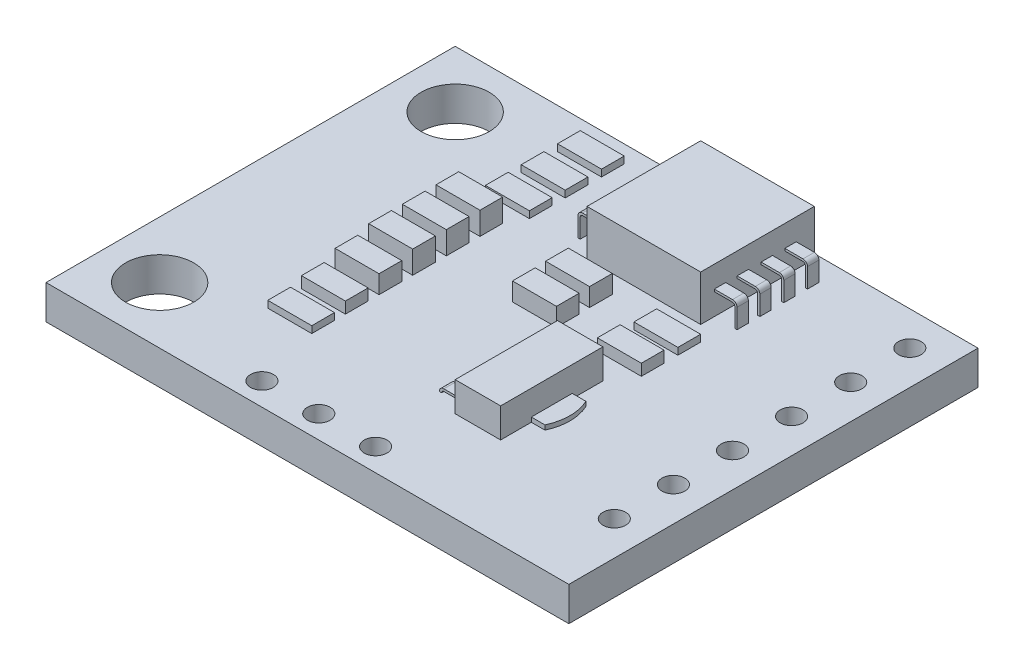
from build123d import *

# Parameters (mm, degrees)
ESBO_O1_W                           = 23
ESBO_O1_H                           = 18
PCB_DEPTH                           = 1.5
ESBO_O7_R                           = 1.5
ESBO_O7_R_2                         = 0.5
FUROS_DEPTH                         = 30.244657632
ESBO_O11_W                          = 5
ESBO_O11_H                          = 5
CHIP_DEPTH                          = 2
ESBO_O12_W                          = 2
ESBO_O12_H                          = 4.5
REGULADOR_TENSAO_DEPTH              = 1.3
ESBO_O13_W                          = 1.934940779
ESBO_O13_H                          = 1
RESISTORES_1_DEPTH                  = 1
ESBO_O14_W                          = 1.934940779
ESBO_O14_H                          = 1
ESBO_O14_W_2                        = 1.934940778
RESISTORES_2_DEPTH                  = 0.8
ESBO_O16_W                          = 1.934940779
ESBO_O16_H                          = 1
LEDS_DEPTH                          = 0.5
ESBO_O17_W                          = 1.934940779
ESBO_O17_H                          = 1
ESBO_O17_W_2                        = 1.934940778
RESISTORES_3_DEPTH                  = 0.3
ESBO_O18_W                          = 0.5
ESBO_O18_H                          = 0.1
CONECTORES_CHIP_1_DEPTH             = 0.8
CONECTORES_START                    = -0.5
CONECTORES_CHIP_2_DEPTH             = 0.5
CONECTORES_CHIP_3_DEPTH             = 0.5
CONECTORES_CHIP_4_DEPTH             = 0.5
CONECTORES_CHIP_5_DEPTH             = 0.5
ESBO_O24_W                          = 0.5
ESBO_O24_H                          = 0.1
CONECTORES_CHIP_6_DEPTH             = 0.8
CONECTORES_CHIP_7_DEPTH             = 0.5
CONECTORES_CHIP_8_DEPTH             = 0.5
CONECTORES_CHIP_9_DEPTH             = 0.5
CONECTORES_CHIP_10_DEPTH            = 0.5
ESBO_O29_W                          = 0.5
ESBO_O29_H                          = 0.1
CONECTORES_REGULADOR_TENSAO_1_DEPTH = 1
CONECTORES_REGULADOR_TENSAO_2_DEPTH = 0.5
CONECTORES_REGULADOR_TENSAO_3_DEPTH = 0.5
CONECTORES_REGULADOR_TENSAO_4_DEPTH = 0.5
CONECTORES_REGULADOR_TENSAO_5_DEPTH = 0.2


with BuildPart() as part:
    # Esboço1 → PCB (new body)
    with BuildSketch(Plane(origin=(0, 0, 0), x_dir=(1, 0, 0), z_dir=(0, 1, 0))):
        Rectangle(ESBO_O1_W, ESBO_O1_H)
    extrude(amount=-PCB_DEPTH)

    # Esboço7 → Furos (cut, through all)
    with BuildSketch(Plane(origin=(-11.5, 0, 9), x_dir=(1, 0, 0), z_dir=(0, 1, 0))):
        with Locations(Location((2.5, 2.5, 0), (0, 0, 270))):
            Circle(ESBO_O7_R)
        with Locations(Location((2.5, 15.5, 0), (0, 0, 270))):
            Circle(ESBO_O7_R)
        with Locations(Location((8.5, 1, 0), (0, 0, 270))):
            Circle(ESBO_O7_R_2)
        with Locations(Location((11, 1, 0), (0, 0, 270))):
            Circle(ESBO_O7_R_2)
        with Locations(Location((21.5, 16.5, 0), (0, 0, 270))):
            Circle(ESBO_O7_R_2)
        with Locations(Location((21.5, 13.9, 0), (0, 0, 270))):
            Circle(ESBO_O7_R_2)
        with Locations(Location((21.5, 11.3, 0), (0, 0, 270))):
            Circle(ESBO_O7_R_2)
        with Locations(Location((21.5, 8.7, 0), (0, 0, 270))):
            Circle(ESBO_O7_R_2)
        with Locations(Location((21.5, 6.1, 0), (0, 0, 270))):
            Circle(ESBO_O7_R_2)
        with Locations(Location((21.5, 3.5, 0), (0, 0, 270))):
            Circle(ESBO_O7_R_2)
        with Locations(Location((13.5, 1, 0), (0, 0, 270))):
            Circle(ESBO_O7_R_2)
    extrude(amount=-FUROS_DEPTH, mode=Mode.SUBTRACT)

    # Esboço11 → CHIP (add)
    with BuildSketch(Plane(origin=(0, 0, 0), x_dir=(1, 0, 0), z_dir=(0, 1, 0))):
        with Locations((2, 6.3)):
            Rectangle(ESBO_O11_W, ESBO_O11_H)
    extrude(amount=CHIP_DEPTH)

    # Esboço12 → Regulador tensao (add)
    with BuildSketch(Plane(origin=(0, 0, 0), x_dir=(1, 0, 0), z_dir=(0, 1, 0))):
        with Locations((3.5, -2.75)):
            Rectangle(ESBO_O12_W, ESBO_O12_H)
    extrude(amount=REGULADOR_TENSAO_DEPTH)

    # Esboço13 → Resistores 1 (add)
    with BuildSketch(Plane(origin=(0, 0, 0), x_dir=(1, 0, 0), z_dir=(0, 1, 0))):
        with Locations((-4.676566778, -0.16)):
            Rectangle(ESBO_O13_W, ESBO_O13_H)
        with Locations((-4.676566778, 1.32)):
            Rectangle(ESBO_O13_W, ESBO_O13_H)
        with Locations((-4.676566778, 2.8)):
            Rectangle(ESBO_O13_W, ESBO_O13_H)
    extrude(amount=RESISTORES_1_DEPTH)

    # Esboço14 → Resistores 2 (add)
    with BuildSketch(Plane(origin=(0, 0, 0), x_dir=(1, 0, 0), z_dir=(0, 1, 0))):
        with Locations((-4.676566778, -1.64)):
            Rectangle(ESBO_O14_W, ESBO_O14_H)
        with Locations((0.444126262, 2.5)):
            Rectangle(ESBO_O14_W_2, ESBO_O14_H)
        with Locations((0.467470389, 1.02)):
            Rectangle(ESBO_O14_W_2, ESBO_O14_H)
    extrude(amount=RESISTORES_2_DEPTH)

    # Esboço16 → LEDs (add)
    with BuildSketch(Plane(origin=(0, 0, 0), x_dir=(1, 0, 0), z_dir=(0, 1, 0))):
        with Locations((-4.676566778, -3.12)):
            Rectangle(ESBO_O16_W, ESBO_O16_H)
        with Locations((4.202411168, 1.02)):
            Rectangle(ESBO_O16_W, ESBO_O16_H)
    extrude(amount=LEDS_DEPTH)

    # Esboço17 → Resistores 3 (add)
    with BuildSketch(Plane(origin=(0, 0, 0), x_dir=(1, 0, 0), z_dir=(0, 1, 0))):
        with Locations((-4.676566778, -4.6)):
            Rectangle(ESBO_O17_W, ESBO_O17_H)
        with Locations((4.202411168, 2.628256432)):
            Rectangle(ESBO_O17_W, ESBO_O17_H)
        with Locations((-4.267470389, 7.73737929)):
            Rectangle(ESBO_O17_W_2, ESBO_O17_H)
        with Locations((-4.267470389, 6.140093457)):
            Rectangle(ESBO_O17_W_2, ESBO_O17_H)
        with Locations((-4.267470389, 4.565956693)):
            Rectangle(ESBO_O17_W_2, ESBO_O17_H)
    extrude(amount=RESISTORES_3_DEPTH)

    # Esboço18 → Conectores CHIP 1 (add)
    with BuildSketch(Plane(origin=(4.5, 0, 0), x_dir=(0, 0, -1), z_dir=(1, 0, 0))):
        with Locations((4.65, 1)):
            Rectangle(ESBO_O18_W, ESBO_O18_H)
        with Locations((5.65388035, 1)):
            Rectangle(ESBO_O18_W, ESBO_O18_H)
        with Locations((6.70860638, 1)):
            Rectangle(ESBO_O18_W, ESBO_O18_H)
        with Locations((7.752288158, 1)):
            Rectangle(ESBO_O18_W, ESBO_O18_H)
    extrude(amount=CONECTORES_CHIP_1_DEPTH)

    # Esboço20 → Conectores CHIP 2 (add)
    with BuildSketch(Plane.XY.offset(-4.4).offset(CONECTORES_START)):
        with BuildLine():
            Line((5.3, 0.95), (5.3, 1.05))
            ThreePointArc((5.3, 1.05), (5.439604183, 0.993215475), (5.499934793, 0.855106721))
            Line((5.499934793, 0.855106721), (5.499934793, 0))
            Line((5.499934793, 0), (5.4, 0))
            Line((5.4, 0), (5.4, 0.85))
            ThreePointArc((5.4, 0.85), (5.370710678, 0.920710678), (5.3, 0.95))
        make_face()
    extrude(amount=CONECTORES_CHIP_2_DEPTH)

    # Esboço21 → Conectores CHIP 3 (add)
    with BuildSketch(Plane.XY.offset(-5.40388035).offset(CONECTORES_START)):
        with BuildLine():
            Line((5.3, 0.95), (5.3, 1.05))
            ThreePointArc((5.3, 1.05), (5.439604183, 0.993215475), (5.499934793, 0.855106721))
            Line((5.499934793, 0.855106721), (5.499934793, 0))
            Line((5.499934793, 0), (5.4, 0))
            Line((5.4, 0), (5.4, 0.85))
            ThreePointArc((5.4, 0.85), (5.370710678, 0.920710678), (5.3, 0.95))
        make_face()
    extrude(amount=CONECTORES_CHIP_3_DEPTH)

    # Esboço22 → Conectores CHIP 4 (add)
    with BuildSketch(Plane.XY.offset(-6.45860638).offset(CONECTORES_START)):
        with BuildLine():
            Line((5.3, 0.95), (5.3, 1.05))
            ThreePointArc((5.3, 1.05), (5.439604183, 0.993215475), (5.499934793, 0.855106721))
            Line((5.499934793, 0.855106721), (5.499934793, 0))
            Line((5.499934793, 0), (5.4, 0))
            Line((5.4, 0), (5.4, 0.85))
            ThreePointArc((5.4, 0.85), (5.370710678, 0.920710678), (5.3, 0.95))
        make_face()
    extrude(amount=CONECTORES_CHIP_4_DEPTH)

    # Esboço23 → Conectores CHIP 5 (add)
    with BuildSketch(Plane.XY.offset(-7.502288158).offset(CONECTORES_START)):
        with BuildLine():
            Line((5.3, 0.95), (5.3, 1.05))
            ThreePointArc((5.3, 1.05), (5.439604183, 0.993215475), (5.499934793, 0.855106721))
            Line((5.499934793, 0.855106721), (5.499934793, 0))
            Line((5.499934793, 0), (5.4, 0))
            Line((5.4, 0), (5.4, 0.85))
            ThreePointArc((5.4, 0.85), (5.370710678, 0.920710678), (5.3, 0.95))
        make_face()
    extrude(amount=CONECTORES_CHIP_5_DEPTH)

    # Esboço24 → Conectores CHIP 6 (add)
    with BuildSketch(Plane.ZY.offset(0.5)):
        with Locations((-7.752288158, 1)):
            Rectangle(ESBO_O24_W, ESBO_O24_H)
        with Locations((-6.70860638, 1)):
            Rectangle(ESBO_O24_W, ESBO_O24_H)
        with Locations((-5.65388035, 1)):
            Rectangle(ESBO_O24_W, ESBO_O24_H)
        with Locations((-4.65, 1)):
            Rectangle(ESBO_O24_W, ESBO_O24_H)
    extrude(amount=CONECTORES_CHIP_6_DEPTH)

    # Esboço25 → Conectores CHIP 7 (add)
    with BuildSketch(Plane(origin=(0, 0, -8.002288158), x_dir=(-1, 0, 0), z_dir=(0, 0, -1)).offset(CONECTORES_START)):
        with BuildLine():
            Line((1.3, 0.95), (1.3, 1.05))
            ThreePointArc((1.3, 1.05), (1.439604183, 0.993215475), (1.499934793, 0.855106721))
            Line((1.499934793, 0.855106721), (1.499934793, 0))
            Line((1.499934793, 0), (1.4, 0))
            Line((1.4, 0), (1.4, 0.85))
            ThreePointArc((1.4, 0.85), (1.370710678, 0.920710678), (1.3, 0.95))
        make_face()
    extrude(amount=CONECTORES_CHIP_7_DEPTH)

    # Esboço26 → Conectores CHIP 8 (add)
    with BuildSketch(Plane(origin=(0, 0, -6.95860638), x_dir=(-1, 0, 0), z_dir=(0, 0, -1)).offset(CONECTORES_START)):
        with BuildLine():
            Line((1.3, 0.95), (1.3, 1.05))
            ThreePointArc((1.3, 1.05), (1.439604183, 0.993215475), (1.499934793, 0.855106721))
            Line((1.499934793, 0.855106721), (1.499934793, 0))
            Line((1.499934793, 0), (1.4, 0))
            Line((1.4, 0), (1.4, 0.85))
            ThreePointArc((1.4, 0.85), (1.370710678, 0.920710678), (1.3, 0.95))
        make_face()
    extrude(amount=CONECTORES_CHIP_8_DEPTH)

    # Esboço27 → Conectores CHIP 9 (add)
    with BuildSketch(Plane(origin=(0, 0, -5.90388035), x_dir=(-1, 0, 0), z_dir=(0, 0, -1)).offset(CONECTORES_START)):
        with BuildLine():
            Line((1.3, 0.95), (1.3, 1.05))
            ThreePointArc((1.3, 1.05), (1.439604183, 0.993215475), (1.499934793, 0.855106721))
            Line((1.499934793, 0.855106721), (1.499934793, 0))
            Line((1.499934793, 0), (1.4, 0))
            Line((1.4, 0), (1.4, 0.85))
            ThreePointArc((1.4, 0.85), (1.370710678, 0.920710678), (1.3, 0.95))
        make_face()
    extrude(amount=CONECTORES_CHIP_9_DEPTH)

    # Esboço28 → Conectores CHIP 10 (add)
    with BuildSketch(Plane(origin=(0, 0, -4.9), x_dir=(-1, 0, 0), z_dir=(0, 0, -1)).offset(CONECTORES_START)):
        with BuildLine():
            Line((1.3, 0.95), (1.3, 1.05))
            ThreePointArc((1.3, 1.05), (1.439604183, 0.993215475), (1.499934793, 0.855106721))
            Line((1.499934793, 0.855106721), (1.499934793, 0))
            Line((1.499934793, 0), (1.4, 0))
            Line((1.4, 0), (1.4, 0.85))
            ThreePointArc((1.4, 0.85), (1.370710678, 0.920710678), (1.3, 0.95))
        make_face()
    extrude(amount=CONECTORES_CHIP_10_DEPTH)

    # Esboço29 → Conectores regulador tensao 1 (add)
    with BuildSketch(Plane.ZY.offset(-2.5)):
        with Locations((1.25, 0.15)):
            Rectangle(ESBO_O29_W, ESBO_O29_H)
        with Locations((2.75, 0.15)):
            Rectangle(ESBO_O29_W, ESBO_O29_H)
        with Locations((4.25, 0.15)):
            Rectangle(ESBO_O29_W, ESBO_O29_H)
    extrude(amount=CONECTORES_REGULADOR_TENSAO_1_DEPTH)

    # Esboço31 → Conectores regulador tensao 2 (add)
    with BuildSketch(Plane.XY.offset(4.5).offset(CONECTORES_START)):
        with BuildLine():
            Line((1.5, 0.2), (1.5, 0.1))
            ThreePointArc((1.5, 0.1), (1.429289322, 0.070710678), (1.4, 0))
            Line((1.4, 0), (1.3, 0))
            ThreePointArc((1.3, 0), (1.358578644, 0.141421356), (1.5, 0.2))
        make_face()
    extrude(amount=CONECTORES_REGULADOR_TENSAO_2_DEPTH)

    # Esboço32 → Conectores regulador tensao 3 (add)
    with BuildSketch(Plane.XY.offset(3).offset(CONECTORES_START)):
        with BuildLine():
            Line((1.5, 0.2), (1.5, 0.1))
            ThreePointArc((1.5, 0.1), (1.429289322, 0.070710678), (1.4, 0))
            Line((1.4, 0), (1.3, 0))
            ThreePointArc((1.3, 0), (1.358578644, 0.141421356), (1.5, 0.2))
        make_face()
    extrude(amount=CONECTORES_REGULADOR_TENSAO_3_DEPTH)

    # Esboço33 → Conectores regulador tensao 4 (add)
    with BuildSketch(Plane.XY.offset(1.5).offset(CONECTORES_START)):
        with BuildLine():
            Line((1.5, 0.2), (1.5, 0.1))
            ThreePointArc((1.5, 0.1), (1.429289322, 0.070710678), (1.4, 0))
            Line((1.4, 0), (1.3, 0))
            ThreePointArc((1.3, 0), (1.358578644, 0.141421356), (1.5, 0.2))
        make_face()
    extrude(amount=CONECTORES_REGULADOR_TENSAO_4_DEPTH)

    # Esboço37 → Conectores regulador tensao 5 (add)
    with BuildSketch(Plane(origin=(0, 0, 0), x_dir=(1, 0, 0), z_dir=(0, 1, 0))):
        with BuildLine():
            Line((4.5, -1.85), (5.1, -1.85))
            ThreePointArc((5.1, -1.85), (5.3, -2.75), (5.1, -3.65))
            Line((5.1, -3.65), (4.5, -3.65))
            Line((4.5, -3.65), (4.5, -1.85))
        make_face()
    extrude(amount=CONECTORES_REGULADOR_TENSAO_5_DEPTH)


solid = part.part
